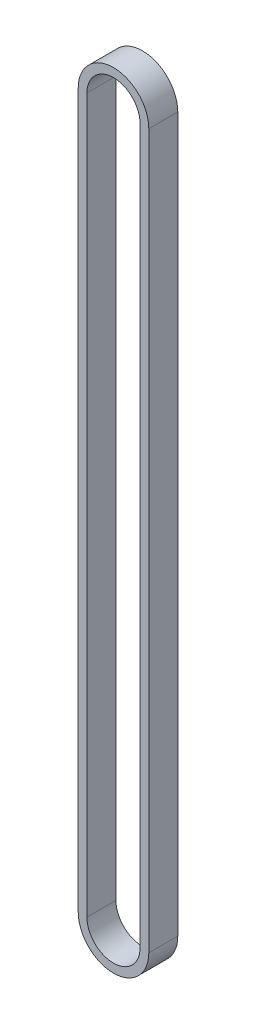
from build123d import *

# Parameters (mm, degrees)
EXTRUDE_1_DEPTH = 10


with BuildPart() as part:
    # 草图1 → 凸台-拉伸1 (new body)
    with BuildSketch(Plane.XY):
        with BuildLine():
            Line((-12.17, -123.1), (-12.17, 123.1))
            ThreePointArc((-12.17, 123.1), (0, 135.27), (12.17, 123.1))
            Line((12.17, 123.1), (12.17, -123.1))
            ThreePointArc((12.17, -123.1), (0, -135.27), (-12.17, -123.1))
        make_face()
        with BuildLine():
            Line((-9.17, -123.1), (-9.17, 123.1))
            ThreePointArc((-9.17, 123.1), (0, 132.27), (9.17, 123.1))
            Line((9.17, 123.1), (9.17, -123.1))
            ThreePointArc((9.17, -123.1), (0, -132.27), (-9.17, -123.1))
        make_face(mode=Mode.SUBTRACT)
    extrude(amount=EXTRUDE_1_DEPTH)


solid = part.part
